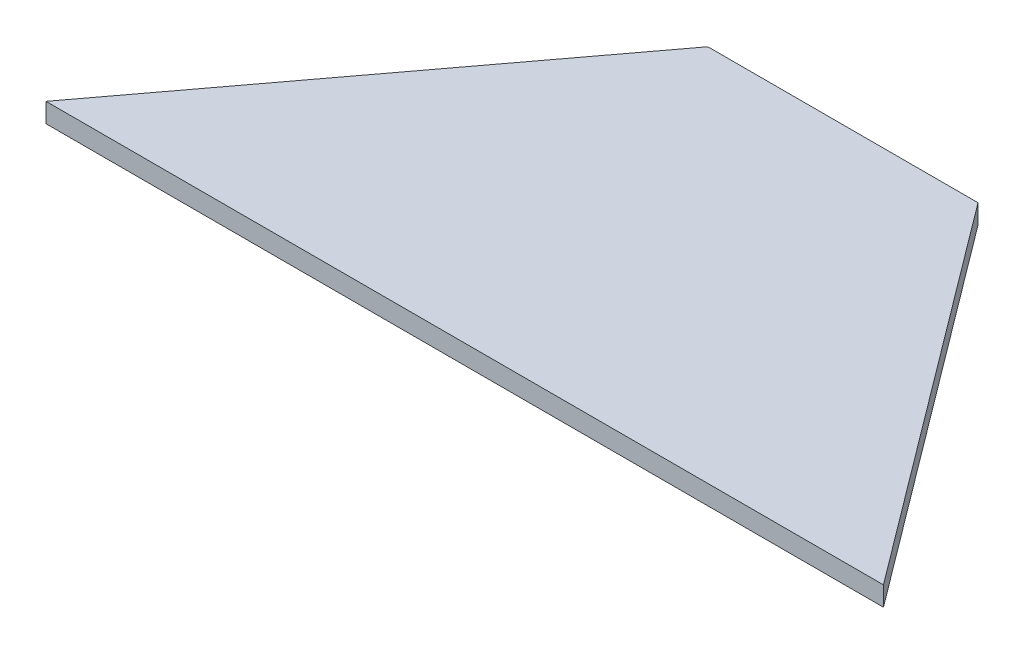
from build123d import *

# Parameters (mm, degrees)
BOSS_EXTRUDE2_DEPTH = 18.25625


with BuildPart() as part:
    # Sketch1 → Boss-Extrude2 (new body)
    with BuildSketch(Plane(origin=(0, 0, 0), x_dir=(1, 0, 0), z_dir=(0, 1, 0))):
        Polygon((-127, -1130.3), (127, -1130.3), (393.7, -1485.9), (-393.7, -1485.9), align=None)
    extrude(amount=BOSS_EXTRUDE2_DEPTH)


solid = part.part
